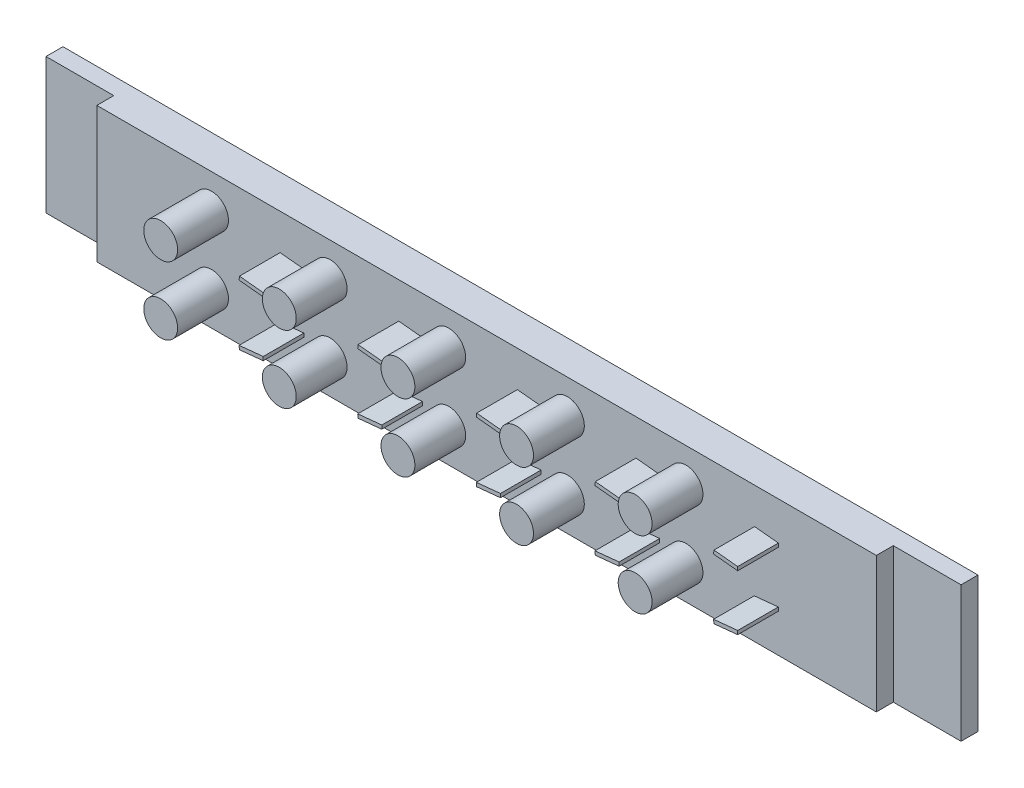
from build123d import *

# Parameters (mm, degrees)
SKETCH_1_W             = 40
SKETCH_1_H             = 80
SKETCH_1_W_2           = 460
SKETCH_1_R             = 10
EXTRUDE_1_DEPTH        = 10
EXTRUDE_START          = 10
SKETCH_1_3_W           = 460
SKETCH_1_3_H           = 80
SKETCH_1_3_R           = 10
EXTRUDE_2_DEPTH        = 10
EXTRUDE_START_2        = -10
SKETCH_1_4_R           = 10
EXTRUDE_3_DEPTH        = 50
EXTRUDE_4_DEPTH        = 24
PATTERN_LINEAR_2_COUNT = 5
PATTERN_LINEAR_2_PITCH = 70


with BuildPart() as part:
    # 草图1 → 凸台-拉伸1 (new body)
    # profile 1 of 3: a face of its own
    with BuildSketch(Plane.XY):
        with Locations((-212.403603398, -15.911028094)):
            Rectangle(SKETCH_1_W, SKETCH_1_H)
    # profile 2 of 3: a face of its own
    with BuildSketch(Plane.XY):
        with Locations((37.596396602, -15.911028094)):
            Rectangle(SKETCH_1_W_2, SKETCH_1_H)
        with Locations((-124.723239389, -35.911028094)):
            Circle(SKETCH_1_R, mode=Mode.SUBTRACT)
        with Locations((-54.723239389, -35.911028094)):
            Circle(SKETCH_1_R, mode=Mode.SUBTRACT)
        with Locations((15.276760611, -35.911028094)):
            Circle(SKETCH_1_R, mode=Mode.SUBTRACT)
        with Locations((85.276760611, -35.911028094)):
            Circle(SKETCH_1_R, mode=Mode.SUBTRACT)
        with Locations((155.276760611, -35.911028094)):
            Circle(SKETCH_1_R, mode=Mode.SUBTRACT)
        with Locations((-124.723239389, 4.088971906)):
            Circle(SKETCH_1_R, mode=Mode.SUBTRACT)
        with Locations((-54.723239389, 4.088971906)):
            Circle(SKETCH_1_R, mode=Mode.SUBTRACT)
        with Locations((15.276760611, 4.088971906)):
            Circle(SKETCH_1_R, mode=Mode.SUBTRACT)
        with Locations((85.276760611, 4.088971906)):
            Circle(SKETCH_1_R, mode=Mode.SUBTRACT)
        with Locations((155.276760611, 4.088971906)):
            Circle(SKETCH_1_R, mode=Mode.SUBTRACT)
    # profile 3 of 3: a face of its own
    with BuildSketch(Plane.XY):
        with Locations((287.596396602, -15.911028094)):
            Rectangle(SKETCH_1_W, SKETCH_1_H)
    extrude(amount=-EXTRUDE_1_DEPTH)

    # 草图1<3> → 凸台-拉伸2 (add)
    with BuildSketch(Plane.XY.offset(EXTRUDE_START)):
        with Locations((37.596396602, -15.911028094)):
            Rectangle(SKETCH_1_3_W, SKETCH_1_3_H)
        with Locations((-124.723239389, -35.911028094)):
            Circle(SKETCH_1_3_R, mode=Mode.SUBTRACT)
        with Locations((-54.723239389, -35.911028094)):
            Circle(SKETCH_1_3_R, mode=Mode.SUBTRACT)
        with Locations((15.276760611, -35.911028094)):
            Circle(SKETCH_1_3_R, mode=Mode.SUBTRACT)
        with Locations((85.276760611, -35.911028094)):
            Circle(SKETCH_1_3_R, mode=Mode.SUBTRACT)
        with Locations((155.276760611, -35.911028094)):
            Circle(SKETCH_1_3_R, mode=Mode.SUBTRACT)
        with Locations((-124.723239389, 4.088971906)):
            Circle(SKETCH_1_3_R, mode=Mode.SUBTRACT)
        with Locations((-54.723239389, 4.088971906)):
            Circle(SKETCH_1_3_R, mode=Mode.SUBTRACT)
        with Locations((15.276760611, 4.088971906)):
            Circle(SKETCH_1_3_R, mode=Mode.SUBTRACT)
        with Locations((85.276760611, 4.088971906)):
            Circle(SKETCH_1_3_R, mode=Mode.SUBTRACT)
        with Locations((155.276760611, 4.088971906)):
            Circle(SKETCH_1_3_R, mode=Mode.SUBTRACT)
    extrude(amount=-EXTRUDE_2_DEPTH)

    # 草图1<4> → 凸台-拉伸3 (add)
    with BuildSketch(Plane.XY.offset(EXTRUDE_START_2)):
        with Locations((-124.723239389, -35.911028094)):
            Circle(SKETCH_1_4_R)
        with Locations((-124.723239389, 4.088971906)):
            Circle(SKETCH_1_4_R)
        with Locations((-54.723239389, -35.911028094)):
            Circle(SKETCH_1_4_R)
        with Locations((15.276760611, -35.911028094)):
            Circle(SKETCH_1_4_R)
        with Locations((85.276760611, 4.088971906)):
            Circle(SKETCH_1_4_R)
        with Locations((155.276760611, 4.088971906)):
            Circle(SKETCH_1_4_R)
        with Locations((-54.723239389, 4.088971906)):
            Circle(SKETCH_1_4_R)
        with Locations((15.276760611, 4.088971906)):
            Circle(SKETCH_1_4_R)
        with Locations((85.276760611, -35.911028094)):
            Circle(SKETCH_1_4_R)
        with Locations((155.276760611, -35.911028094)):
            Circle(SKETCH_1_4_R)
    extrude(amount=EXTRUDE_3_DEPTH)

    # 草图2 → 凸台-拉伸4 (add)
    with BuildSketch(Plane.XY.offset(10)):
        Polygon((-70.214292819, 1.512613092), (-84.238622357, 2.9154911), (-84.454570484, 0.756694909), (-70.214292819, -0.667784764), align=None)
        Polygon((-70.214292819, -31.154271424), (-70.214292819, -33.334669281), (-84.238622357, -34.737547289), (-84.454570484, -32.578751098), align=None)
    extrude_4 = extrude(amount=EXTRUDE_4_DEPTH)

    # 阵列(线性)2: 凸台-拉伸4 ×5
    with Locations(*[(i * PATTERN_LINEAR_2_PITCH, 0, 0) for i in range(1, PATTERN_LINEAR_2_COUNT)]):
        add(extrude_4)


solid = part.part
